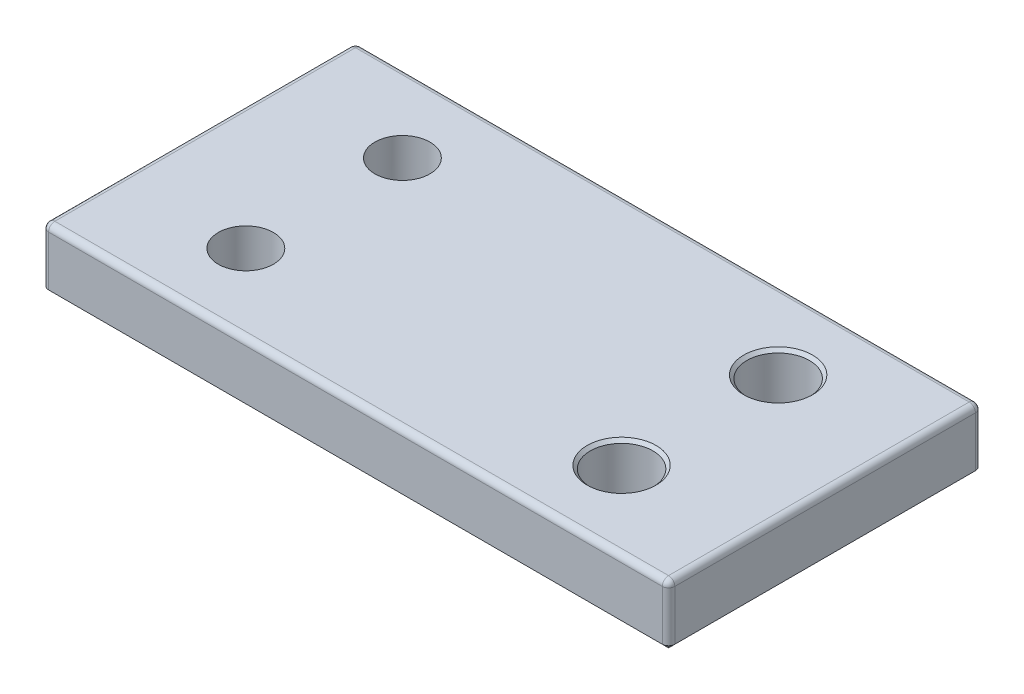
from build123d import *

# Parameters (mm, degrees)
SKETCH_1_W       = 100
SKETCH_1_H       = 50
EXTRUDE_1_DEPTH  = 10
F_10_0MM_1_D     = 10
F_10_0MM_1_DEPTH = 23.75
F_10_0MM_1_TIP   = 3.004303095
M10X1_25_1_D     = 8.8
M10X1_25_1_DEPTH = 23.75
M10X1_25_1_TIP   = 2.643786724
FILLET_1_R       = 1
CHAMFER_1_SIZE   = 1
CHAMFER_2_SIZE   = 0.5
FILLET_2_R       = 1


with BuildPart() as part:
    # 草圖1 → 填料-伸長1 (new body)
    with BuildSketch(Plane(origin=(0, 0, 0), x_dir=(1, 0, 0), z_dir=(0, 1, 0))):
        with Locations((50, 25)):
            Rectangle(SKETCH_1_W, SKETCH_1_H)
    extrude(amount=EXTRUDE_1_DEPTH)

    # Ø10.0mm 定位孔1
    with Locations(Plane(origin=(80, 10, -37.5), x_dir=(0, 0, 1), z_dir=(0, 1, 0))):
        with Locations((0, 0), (25, 0)):
            Hole(F_10_0MM_1_D / 2, depth=F_10_0MM_1_DEPTH)
            with Locations((0, 0, -(F_10_0MM_1_DEPTH + F_10_0MM_1_TIP / 2))):  # 118° drill point
                Cone(0, F_10_0MM_1_D / 2, F_10_0MM_1_TIP, mode=Mode.SUBTRACT)

    # M10x1.25 螺紋孔1
    with Locations(Plane(origin=(20, 10, -37.5), x_dir=(0, 0, 1), z_dir=(0, 1, 0))):
        with Locations((0, 0), (25, 0)):
            Hole(M10X1_25_1_D / 2, depth=M10X1_25_1_DEPTH)
            with Locations((0, 0, -(M10X1_25_1_DEPTH + M10X1_25_1_TIP / 2))):  # 118° drill point
                Cone(0, M10X1_25_1_D / 2, M10X1_25_1_TIP, mode=Mode.SUBTRACT)

    # 圓角1
    fillet_1_edges = [part.edges().sort_by_distance(p)[0] for p in [
        (0, 5, -50),
        (100, 5, -50),
        (100, 5, 0),
        (0, 5, 0),
    ]]
    fillet(fillet_1_edges, radius=FILLET_1_R)

    # 導角1
    chamfer_1_edges = [part.edges().sort_by_distance(p)[0] for p in [
        (50, 0, -50),
        (0, 0, -25),
        (100, 0, -25),
        (50, 0, 0),
        (99.707106781, 0, -0.292893219),
        (0.292893219, 0, -0.292893219),
        (0.292893219, 0, -49.707106781),
        (99.707106781, 0, -49.707106781),
    ]]
    chamfer(chamfer_1_edges, length=CHAMFER_1_SIZE)

    # 導角2
    chamfer_2_edges = [part.edges().sort_by_distance(p)[0] for p in [
        (80, 10, -7.5),
        (80, 10, -32.5),
    ]]
    chamfer(chamfer_2_edges, length=CHAMFER_2_SIZE)

    # 圓角2
    fillet_2_edges = [part.edges().sort_by_distance(p)[0] for p in [
        (50, 10, -50),
        (100, 10, -25),
        (0, 10, -25),
        (50, 10, 0),
        (99.707106781, 10, -0.292893219),
        (0.292893219, 10, -0.292893219),
        (0.292893219, 10, -49.707106781),
        (99.707106781, 10, -49.707106781),
    ]]
    fillet(fillet_2_edges, radius=FILLET_2_R)


solid = part.part
